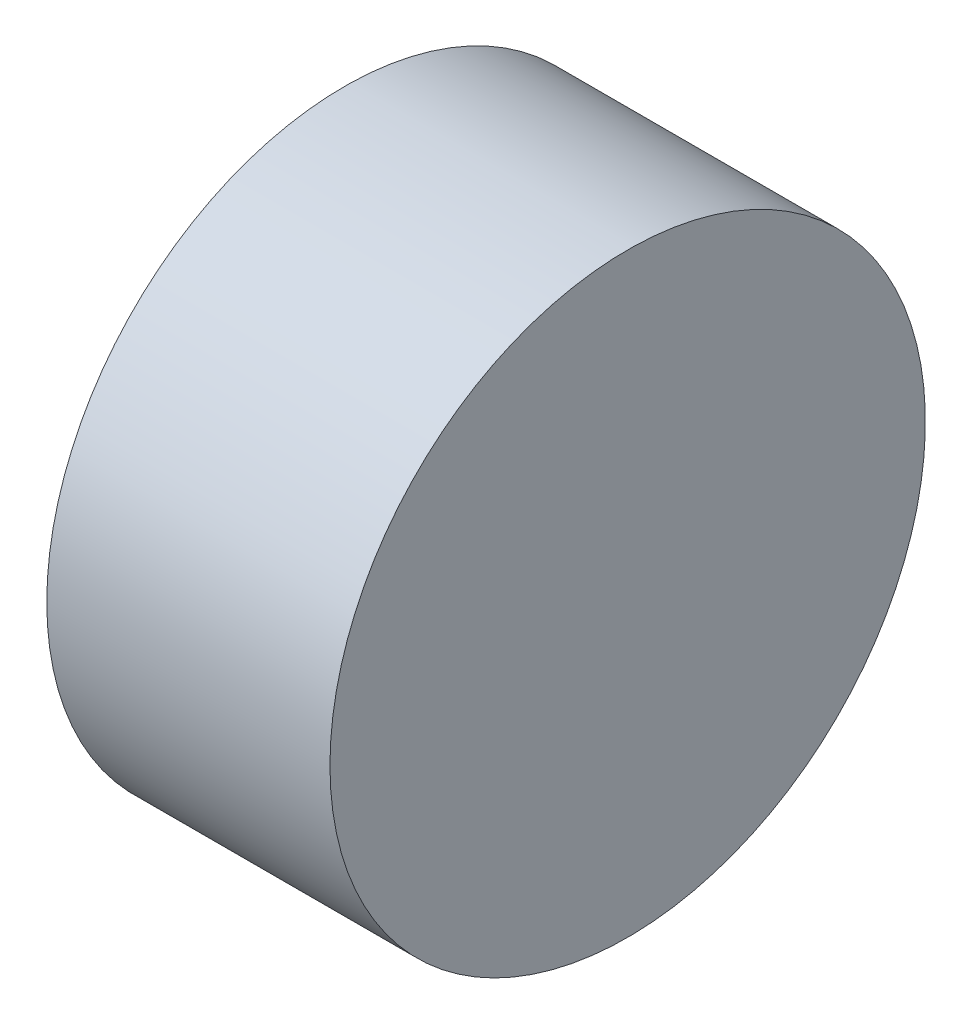
from build123d import *


with BuildPart() as part:
    # Sketch1 → Revolve2 (revolve)
    with BuildSketch(Plane.XY, mode=Mode.PRIVATE) as revolve2_sk:
        with BuildLine():
            Line((3.127292086, 0.65299376), (4.524081096, 0.65299376))
            Line((4.524081096, 0.65299376), (4.524081096, 6.687681375))
            Line((4.524081096, 6.687681375), (-1.215483574, 6.687681375))
            Line((-1.215483574, 6.687681375), (-1.215483574, 3.603710136))
            ThreePointArc((-1.215483574, 3.603710136), (1.724750806, 3.259917187), (3.127292086, 0.65299376))
        make_face()
    revolve(revolve2_sk.sketch.rotate(Axis((3.127292086, 0.65299376, 0), (1, 0, 0)), 90), axis=Axis((3.127292086, 0.65299376, 0), (1, 0, 0)))


solid = part.part
